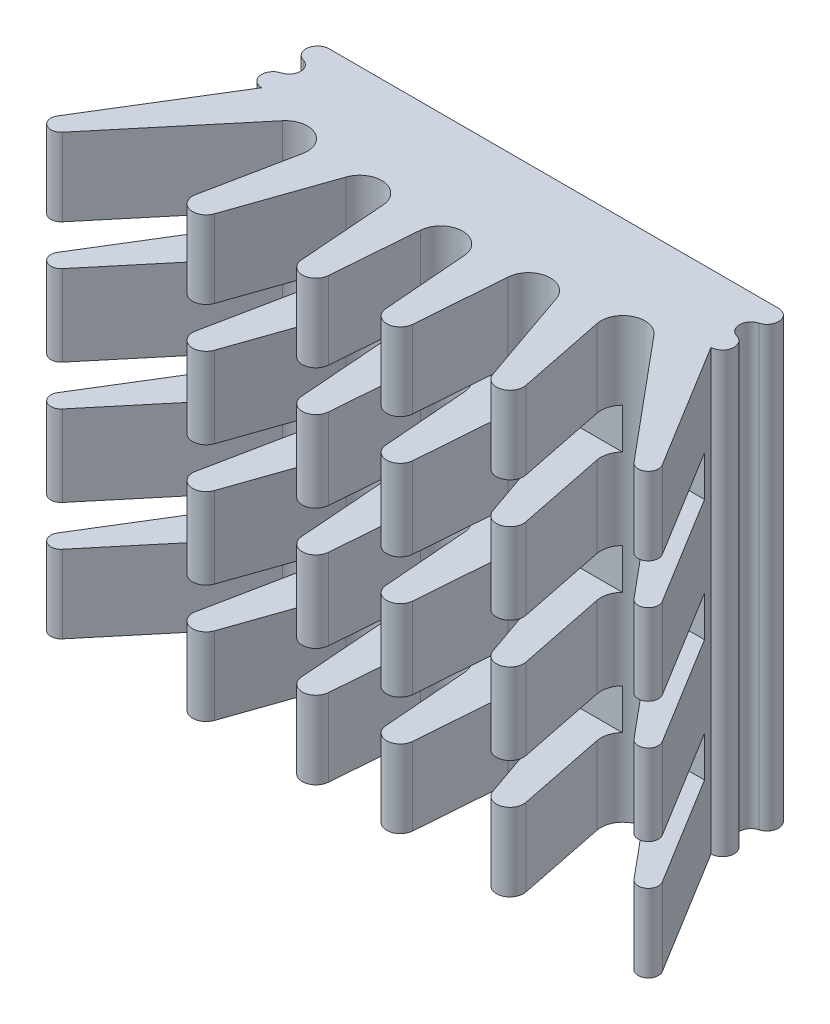
from build123d import *

# Parameters (mm, degrees)
EXTRUDE_1_DEPTH          = 6.5
CUT_EXTRUDE_1_DEPTH      = 13.71573828
CUT_EXTRUDE_1_DEPTH_BACK = 13.71573828
SKETCH_2_W               = 3.7
SKETCH_2_H               = 1.2


with BuildPart() as part:
    # Эскиз1 → Бобышка-Вытянуть1 (new, symmetric)
    with BuildSketch(Plane(origin=(0, 0, 0), x_dir=(1, 0, 0), z_dir=(0, 1, 0))):
        with BuildLine():
            Line((-6.658312395, 0), (6.658312395, 0))
            ThreePointArc((6.658312395, 0), (6.996852653, -0.295417601), (6.75, -0.670843802))
            ThreePointArc((6.75, -0.670843802), (6.5, -1), (6.75, -1.329156198))
            ThreePointArc((6.75, -1.329156198), (6.996852653, -1.704582399), (6.658312395, -2))
            Line((6.658312395, -2), (8.955547022, -5.741842995))
            ThreePointArc((8.955547022, -5.741842995), (8.874693562, -6.143507105), (8.468237531, -6.091885079))
            Line((8.468237531, -6.091885079), (5.500699092, -2.534366135))
            ThreePointArc((5.500699092, -2.534366135), (4.718050783, -2.364111944), (4.360854377, -3.081004957))
            Line((4.360854377, -3.081004957), (4.893274759, -5.719437316))
            ThreePointArc((4.893274759, -5.719437316), (4.605767966, -6.185807283), (4.121027011, -5.930489228))
            Line((4.121027011, -5.930489228), (3.115902551, -3.038005813))
            ThreePointArc((3.115902551, -3.038005813), (2.415953046, -2.605439542), (1.849849185, -3.202573787))
            Line((1.849849185, -3.202573787), (1.650046399, -5.829228376))
            ThreePointArc((1.650046399, -5.829228376), (1.250599943, -6.199999551), (0.850046399, -5.830424668))
            Line((0.850046399, -5.830424668), (0.65, -3.300629586))
            ThreePointArc((0.65, -3.300629586), (0, -2.7), (-0.65, -3.300629586))
            Line((-0.65, -3.300629586), (-0.850046399, -5.830424668))
            ThreePointArc((-0.850046399, -5.830424668), (-1.250599943, -6.199999551), (-1.650046399, -5.829228376))
            Line((-1.650046399, -5.829228376), (-1.849849185, -3.202573787))
            ThreePointArc((-1.849849185, -3.202573787), (-2.415953046, -2.605439542), (-3.115902551, -3.038005813))
            Line((-3.115902551, -3.038005813), (-4.121027011, -5.930489228))
            ThreePointArc((-4.121027011, -5.930489228), (-4.605767966, -6.185807283), (-4.893274759, -5.719437316))
            Line((-4.893274759, -5.719437316), (-4.360854377, -3.081004957))
            ThreePointArc((-4.360854377, -3.081004957), (-4.718050783, -2.364111944), (-5.500699092, -2.534366135))
            Line((-5.500699092, -2.534366135), (-8.468237531, -6.091885079))
            ThreePointArc((-8.468237531, -6.091885079), (-8.874693562, -6.143507105), (-8.955547022, -5.741842995))
            Line((-8.955547022, -5.741842995), (-6.658312395, -2))
            ThreePointArc((-6.658312395, -2), (-6.996852653, -1.704582399), (-6.75, -1.329156198))
            ThreePointArc((-6.75, -1.329156198), (-6.5, -1), (-6.75, -0.670843802))
            ThreePointArc((-6.75, -0.670843802), (-6.996852653, -0.295417601), (-6.658312395, 0))
        make_face()
    extrude(amount=EXTRUDE_1_DEPTH, both=True)

    # Эскиз2 → Вырез-Вытянуть1 (cut, two sides: drawn at the far end of the back side and taken through both)
    with BuildSketch(Plane(origin=(0, 0, 0), x_dir=(0, 0, -1), z_dir=(1, 0, 0)).offset(-CUT_EXTRUDE_1_DEPTH_BACK)):
        with Locations((-4.35, -3.6)):
            Rectangle(SKETCH_2_W, SKETCH_2_H)
        with Locations((-4.35, 0)):
            Rectangle(SKETCH_2_W, SKETCH_2_H)
        with Locations((-4.35, 3.6)):
            Rectangle(SKETCH_2_W, SKETCH_2_H)
    extrude(amount=CUT_EXTRUDE_1_DEPTH + CUT_EXTRUDE_1_DEPTH_BACK, mode=Mode.SUBTRACT)


solid = part.part
